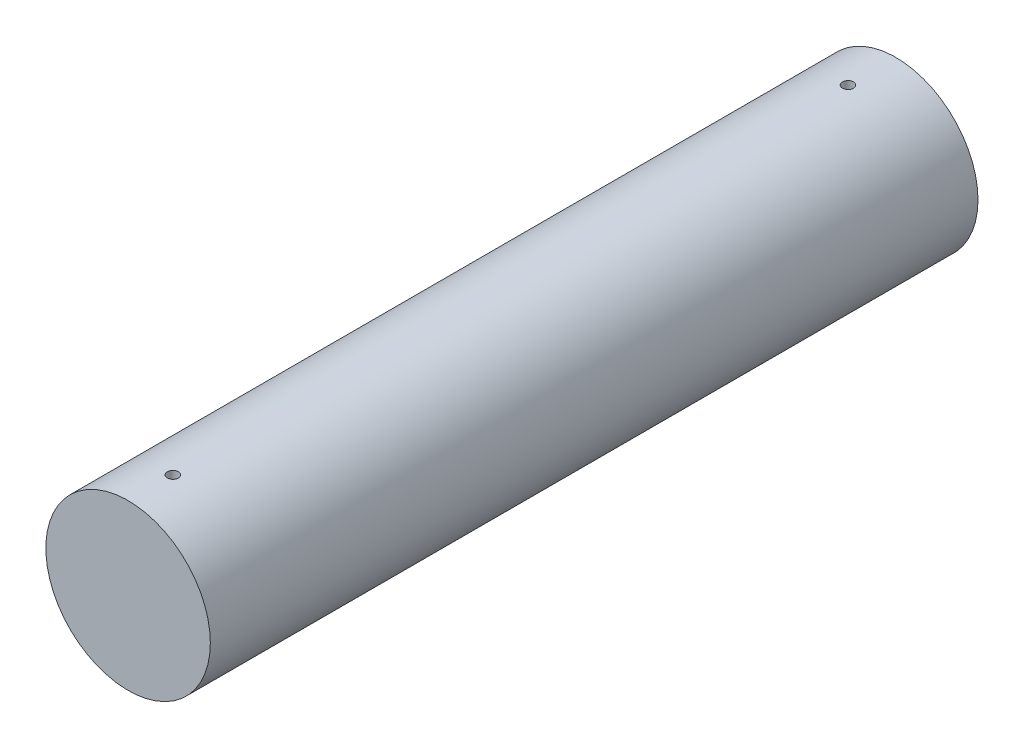
from build123d import *

# Parameters (mm, degrees)
SCHIZZO1_R                    = 75
ESTRUSIONE_ESTRUSIONE1_DEPTH  = 700
TAGLIO_ESTRUSIONE1_DEPTH      = 708.990112925
TAGLIO_ESTRUSIONE1_DEPTH_BACK = 708.990112925
SCHIZZO2_R                    = 5
TAGLIO_ESTRUSIONE2_DEPTH      = 708.990113045
TAGLIO_ESTRUSIONE2_DEPTH_BACK = 708.990113045
SCHIZZO3_R                    = 5


with BuildPart() as part:
    # Schizzo1 → Estrusione-Estrusione1 (new body)
    with BuildSketch(Plane.XY):
        Circle(SCHIZZO1_R)
    extrude(amount=ESTRUSIONE_ESTRUSIONE1_DEPTH)

    # Schizzo2 → Taglio-Estrusione1 (cut, two sides: drawn at the far end of the back side and taken through both)
    with BuildSketch(Plane(origin=(0, 0, 0), x_dir=(1, 0, 0), z_dir=(0, 1, 0)).offset(-TAGLIO_ESTRUSIONE1_DEPTH_BACK)):
        with Locations(Location((0, -43.632162592, 0), (0, 0, 270))):
            Circle(SCHIZZO2_R)
    extrude(amount=TAGLIO_ESTRUSIONE1_DEPTH + TAGLIO_ESTRUSIONE1_DEPTH_BACK, mode=Mode.SUBTRACT)

    # Schizzo3 → Taglio-Estrusione2 (cut, two sides: drawn at the far end of the back side and taken through both)
    with BuildSketch(Plane(origin=(0, 0, 0), x_dir=(1, 0, 0), z_dir=(0, 1, 0)).offset(-TAGLIO_ESTRUSIONE2_DEPTH_BACK)):
        with Locations(Location((0, -659.26265162, 0), (0, 0, 270))):
            Circle(SCHIZZO3_R)
    extrude(amount=TAGLIO_ESTRUSIONE2_DEPTH + TAGLIO_ESTRUSIONE2_DEPTH_BACK, mode=Mode.SUBTRACT)


solid = part.part
